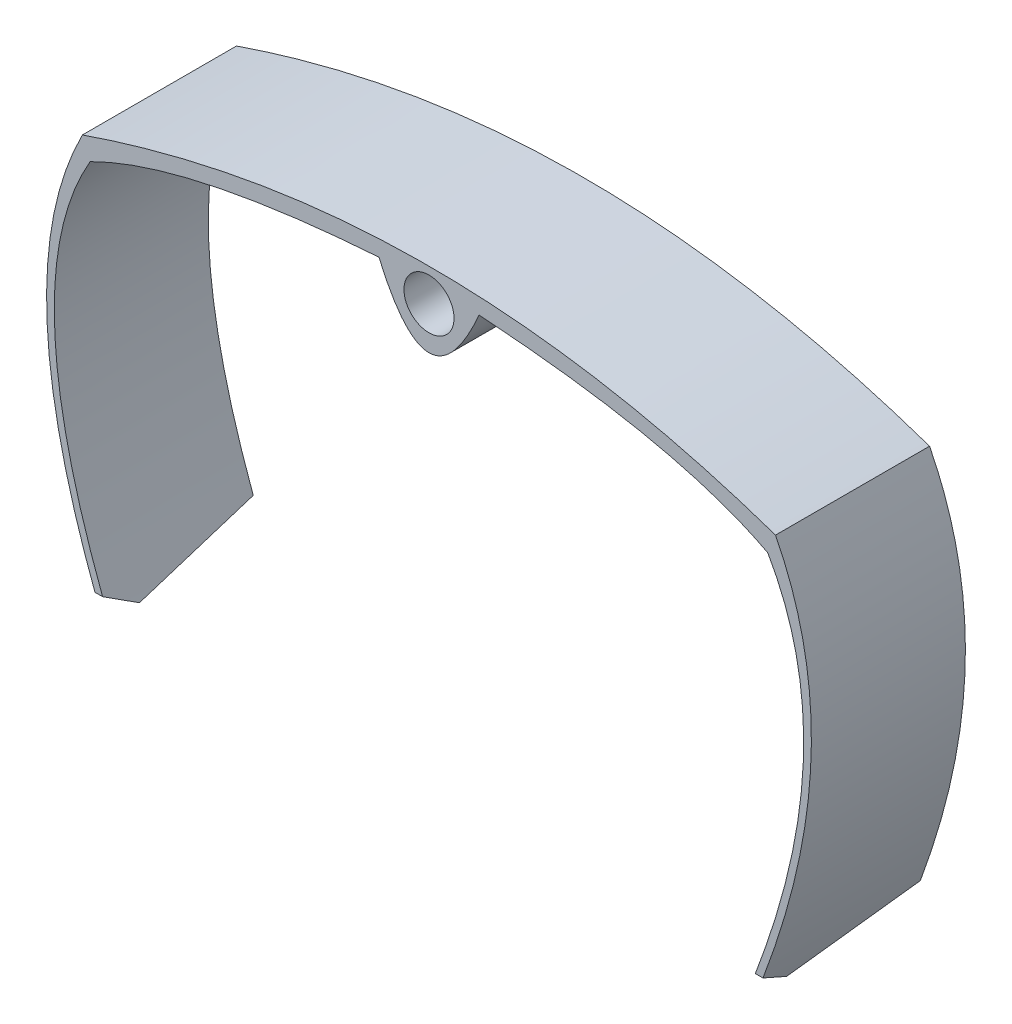
from build123d import *

# Parameters (mm, degrees)
SKETCH_1_R               = 3.25
EXTRUDE_1_DEPTH          = 20
CUT_EXTRUDE_1_DEPTH      = 81.408360659
CUT_EXTRUDE_1_DEPTH_BACK = 81.408360659


with BuildPart() as part:
    # 草圖1 → 填料-伸長1 (new body)
    with BuildSketch(Plane.XY):
        with BuildLine():
            Line((-41, -60), (-40, -60))
            add(Edge.make_bspline(
                [(-44, -6), (-55, -25), (-40, -60)],
                knots=[0, 0, 0, 1, 1, 1], degree=2))
            add(Edge.make_bspline(
                [(-6.5, 2), (-31.607950909, 0.274777248), (-44, -6)],
                knots=[0, 0, 0, 1, 1, 1], degree=2))
            add(Edge.make_bspline(
                [(-6.5, 2), (0, -13), (6.5, 2)],
                knots=[0, 0, 0, 1, 1, 1], degree=2))
            add(Edge.make_bspline(
                [(6.5, 2), (32.228671013, 0.274777248), (44, -6)],
                knots=[0, 0, 0, 1, 1, 1], degree=2))
            add(Edge.make_bspline(
                [(44, -6), (55, -25), (40, -60)],
                knots=[0, 0, 0, 1, 1, 1], degree=2))
            Line((40, -60), (41, -60))
            add(Edge.make_bspline(
                [(45, -3.5), (56, -25), (41, -60)],
                knots=[0, 0, 0, 1, 1, 1], degree=2))
            add(Edge.make_bspline(
                [(-45, -3.5), (0, 12), (45, -3.5)],
                knots=[0, 0, 0, 1, 1, 1], degree=2))
            add(Edge.make_bspline(
                [(-45, -3.5), (-56, -25), (-41, -60)],
                knots=[0, 0, 0, 1, 1, 1], degree=2))
        make_face()
        Circle(SKETCH_1_R, mode=Mode.SUBTRACT)
    extrude(amount=EXTRUDE_1_DEPTH)

    # 草圖2 → 除料-伸長1 (cut, two sides: drawn at the far end of the back side and taken through both)
    with BuildSketch(Plane(origin=(0, 0, 0), x_dir=(0, 0, -1), z_dir=(1, 0, 0)).offset(-CUT_EXTRUDE_1_DEPTH_BACK)):
        Polygon((-24.134552524, -51.791662607), (-16.07391568, -56.330917091), (-3.22546812, -53.625137827), (5.975024699, -51.687588362), (8.544692021, -68.58770729), (2.04714525, -71.745430098), (-25.301795002, -71.006269551), align=None)
    extrude(amount=CUT_EXTRUDE_1_DEPTH + CUT_EXTRUDE_1_DEPTH_BACK, mode=Mode.SUBTRACT)


solid = part.part
